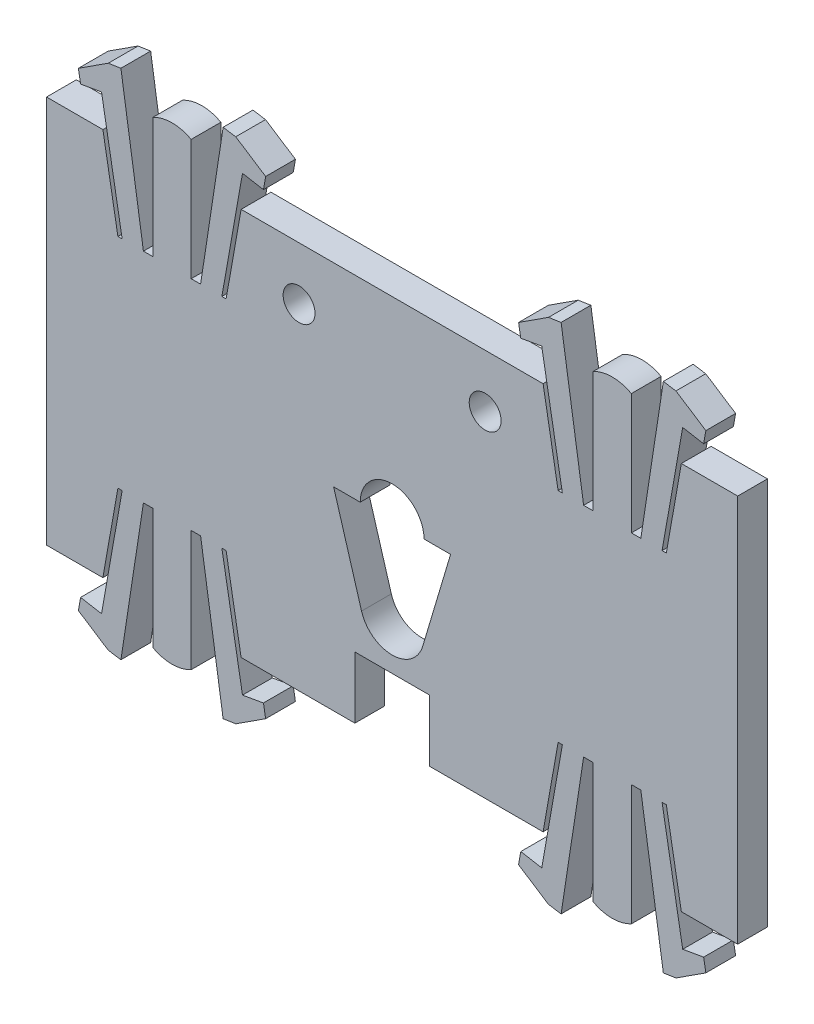
from build123d import *

# Parameters (mm, degrees)
MODEL_R                 = 1.5
P_IDAT_VYSUNUT_M1_DEPTH = 2.8


with BuildPart() as part:
    # Model → Přidat vysunutím1 (new body)
    with BuildSketch(Plane.XY):
        with BuildLine():
            Line((-14.2, 18.25), (14.2, 18.25))
            Line((14.2, 18.25), (15.610615846, 10.25))
            Line((15.610615846, 10.25), (16.010615846, 10.25))
            Line((16.010615846, 10.25), (14.071019058, 21.25))
            Line((14.071019058, 21.25), (12.101403552, 20.902703645))
            Line((12.101403552, 20.902703645), (11.893025739, 22.084472948))
            Line((11.893025739, 22.084472948), (14.706771698, 23.907401431))
            Line((14.706771698, 23.907401431), (15.892964362, 24.088914415))
            Line((15.892964362, 24.088914415), (18.010615846, 10.25))
            Line((18.010615846, 10.25), (18.9, 10.25))
            Line((18.9, 10.25), (18.9, 21.596640106))
            ThreePointArc((18.9, 21.596640106), (20.7, 22.05), (22.5, 21.596640106))
            Line((22.5, 21.596640106), (22.5, 10.25))
            Line((22.5, 10.25), (23.389384154, 10.25))
            Line((23.389384154, 10.25), (25.507035638, 24.088914415))
            Line((25.507035638, 24.088914415), (26.693228302, 23.907401431))
            Line((26.693228302, 23.907401431), (29.506974261, 22.084472948))
            Line((29.506974261, 22.084472948), (29.298596448, 20.902703645))
            Line((29.298596448, 20.902703645), (27.328980942, 21.25))
            Line((27.328980942, 21.25), (25.389384154, 10.25))
            Line((25.389384154, 10.25), (25.789384154, 10.25))
            Line((25.789384154, 10.25), (27.2, 18.25))
            Line((27.2, 18.25), (32.5, 18.25))
            Line((32.5, 18.25), (32.5, -18.25))
            Line((32.5, -18.25), (27.2, -18.25))
            Line((27.2, -18.25), (25.789384154, -10.25))
            Line((25.789384154, -10.25), (25.389384154, -10.25))
            Line((25.389384154, -10.25), (27.328980942, -21.25))
            Line((27.328980942, -21.25), (29.298596448, -20.902703645))
            Line((29.298596448, -20.902703645), (29.506974261, -22.084472948))
            Line((29.506974261, -22.084472948), (26.693228302, -23.907401431))
            Line((26.693228302, -23.907401431), (25.507035638, -24.088914415))
            Line((25.507035638, -24.088914415), (23.389384154, -10.25))
            Line((23.389384154, -10.25), (22.5, -10.25))
            Line((22.5, -10.25), (22.5, -21.596640106))
            ThreePointArc((22.5, -21.596640106), (20.7, -22.05), (18.9, -21.596640106))
            Line((18.9, -21.596640106), (18.9, -10.25))
            Line((18.9, -10.25), (18.010615846, -10.25))
            Line((18.010615846, -10.25), (15.892964362, -24.088914415))
            Line((15.892964362, -24.088914415), (14.706771698, -23.907401431))
            Line((14.706771698, -23.907401431), (11.893025739, -22.084472948))
            Line((11.893025739, -22.084472948), (12.101403552, -20.902703645))
            Line((12.101403552, -20.902703645), (14.071019058, -21.25))
            Line((14.071019058, -21.25), (16.010615846, -10.25))
            Line((16.010615846, -10.25), (15.610615846, -10.25))
            Line((15.610615846, -10.25), (14.2, -18.25))
            Line((14.2, -18.25), (3.5, -18.25))
            Line((3.5, -18.25), (3.5, -12.45))
            Line((3.5, -12.45), (-3.5, -12.45))
            Line((-3.5, -12.45), (-3.5, -18.25))
            Line((-3.5, -18.25), (-14.2, -18.25))
            Line((-14.2, -18.25), (-15.610615846, -10.25))
            Line((-15.610615846, -10.25), (-16.010615846, -10.25))
            Line((-16.010615846, -10.25), (-14.071019058, -21.25))
            Line((-14.071019058, -21.25), (-12.101403552, -20.902703645))
            Line((-12.101403552, -20.902703645), (-11.893025739, -22.084472948))
            Line((-11.893025739, -22.084472948), (-14.706771698, -23.907401431))
            Line((-14.706771698, -23.907401431), (-15.892964362, -24.088914415))
            Line((-15.892964362, -24.088914415), (-18.010615846, -10.25))
            Line((-18.010615846, -10.25), (-18.9, -10.25))
            Line((-18.9, -10.25), (-18.9, -21.596640106))
            ThreePointArc((-18.9, -21.596640106), (-20.7, -22.05), (-22.5, -21.596640106))
            Line((-22.5, -21.596640106), (-22.5, -10.25))
            Line((-22.5, -10.25), (-23.389384154, -10.25))
            Line((-23.389384154, -10.25), (-25.507035638, -24.088914415))
            Line((-25.507035638, -24.088914415), (-26.693228302, -23.907401431))
            Line((-26.693228302, -23.907401431), (-29.506974261, -22.084472948))
            Line((-29.506974261, -22.084472948), (-29.298596448, -20.902703645))
            Line((-29.298596448, -20.902703645), (-27.328980942, -21.25))
            Line((-27.328980942, -21.25), (-25.389384154, -10.25))
            Line((-25.389384154, -10.25), (-25.789384154, -10.25))
            Line((-25.789384154, -10.25), (-27.2, -18.25))
            Line((-27.2, -18.25), (-32.5, -18.25))
            Line((-32.5, -18.25), (-32.5, 18.25))
            Line((-32.5, 18.25), (-27.2, 18.25))
            Line((-27.2, 18.25), (-25.789384154, 10.25))
            Line((-25.789384154, 10.25), (-25.389384154, 10.25))
            Line((-25.389384154, 10.25), (-27.328980942, 21.25))
            Line((-27.328980942, 21.25), (-29.298596448, 20.902703645))
            Line((-29.298596448, 20.902703645), (-29.506974261, 22.084472948))
            Line((-29.506974261, 22.084472948), (-26.693228302, 23.907401431))
            Line((-26.693228302, 23.907401431), (-25.507035638, 24.088914415))
            Line((-25.507035638, 24.088914415), (-23.389384154, 10.25))
            Line((-23.389384154, 10.25), (-22.5, 10.25))
            Line((-22.5, 10.25), (-22.5, 21.596640106))
            ThreePointArc((-22.5, 21.596640106), (-20.7, 22.05), (-18.9, 21.596640106))
            Line((-18.9, 21.596640106), (-18.9, 10.25))
            Line((-18.9, 10.25), (-18.010615846, 10.25))
            Line((-18.010615846, 10.25), (-15.892964362, 24.088914415))
            Line((-15.892964362, 24.088914415), (-14.706771698, 23.907401431))
            Line((-14.706771698, 23.907401431), (-11.893025739, 22.084472948))
            Line((-11.893025739, 22.084472948), (-12.101403552, 20.902703645))
            Line((-12.101403552, 20.902703645), (-14.071019058, 21.25))
            Line((-14.071019058, 21.25), (-16.010615846, 10.25))
            Line((-16.010615846, 10.25), (-15.610615846, 10.25))
            Line((-15.610615846, 10.25), (-14.2, 18.25))
        make_face()
        with Locations((-8.75, 13.25)):
            Circle(MODEL_R, mode=Mode.SUBTRACT)
        with Locations(Location((8.75, 13.25, 0), (0, 0, 180))):
            Circle(MODEL_R, mode=Mode.SUBTRACT)
        with BuildLine():
            Line((2.875009535, -8.806924836), (5.5, 0))
            Line((5.5, 0), (3, 0))
            ThreePointArc((3, 0), (0, 3), (-3, 0))
            Line((-3, 0), (-5.5, 0))
            Line((-5.5, 0), (-2.875009535, -8.806924836))
            ThreePointArc((-2.875009535, -8.806924836), (0, -10.95), (2.875009535, -8.806924836))
        make_face(mode=Mode.SUBTRACT)
    extrude(amount=P_IDAT_VYSUNUT_M1_DEPTH)


solid = part.part
